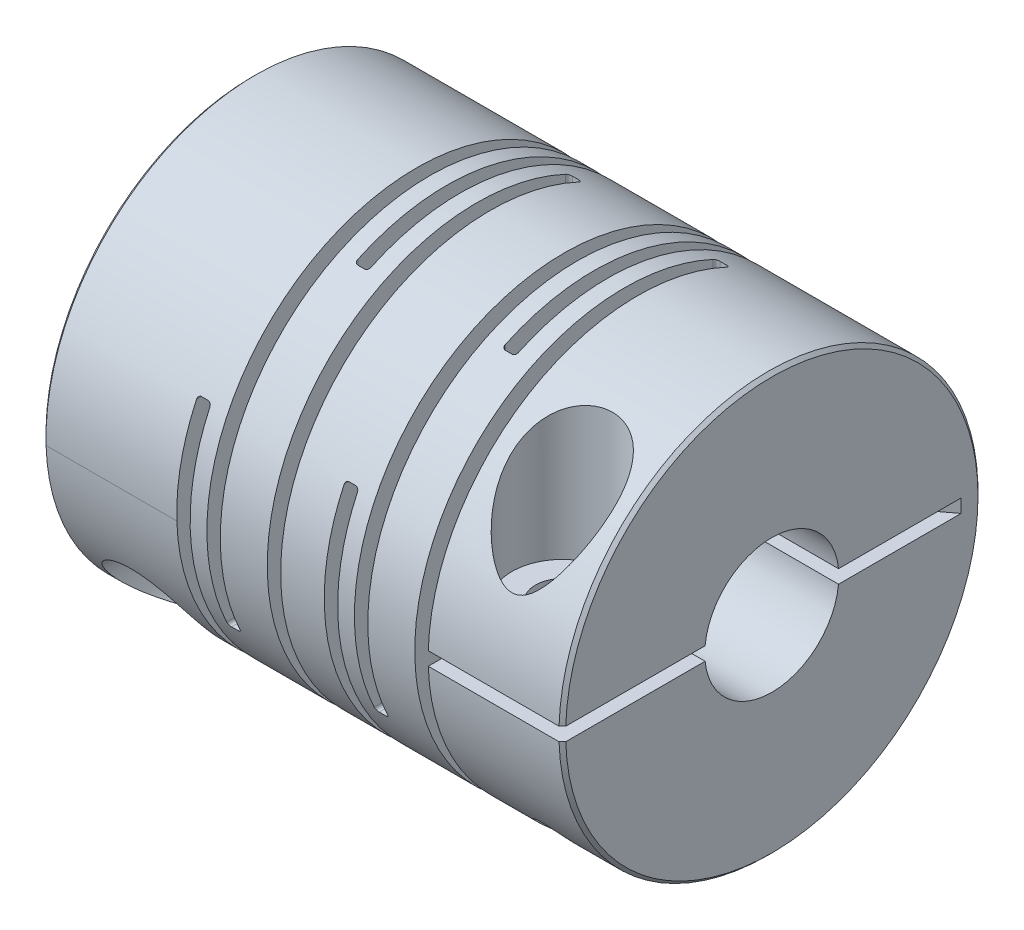
from build123d import *

# Parameters (mm, degrees)
SKETCH1_W                          = 31
SKETCH1_H                          = 12.5
CUT_EXTRUDE1_DEPTH                 = 42.740268327
CUT_EXTRUDE2_DEPTH                 = 42.740268491
CHAMFER1_SIZE                      = 0.2
CUT_EXTRUDE3_DEPTH                 = 0.4
CUT_EXTRUDE4_DEPTH                 = 0.4
SOCKET_HEAD_CAP_SCREW1_D           = 3.2
SOCKET_HEAD_CAP_SCREW1_DEPTH       = 12.1
SOCKET_HEAD_CAP_SCREW1_CBORE_D     = 6
SOCKET_HEAD_CAP_SCREW1_CBORE_DEPTH = 9.5
TAP1_D                             = 2.459
SOCKET_HEAD_CAP_SCREW2_D           = 3.2
SOCKET_HEAD_CAP_SCREW2_DEPTH       = 12.1
SOCKET_HEAD_CAP_SCREW2_CBORE_D     = 6
SOCKET_HEAD_CAP_SCREW2_CBORE_DEPTH = 9.5
TAP2_D                             = 2.459
SKETCH15_W                         = 15
SKETCH15_H                         = 4.25
SKETCH17_R                         = 4
CUT_EXTRUDE5_DEPTH                 = 8
CUT_EXTRUDE6_START                 = -8
SKETCH18_R                         = 4
CUT_EXTRUDE6_DEPTH                 = 8


with BuildPart() as part:
    # Sketch1 → Revolve1 (revolve)
    with BuildSketch(Plane.XY, mode=Mode.PRIVATE) as revolve1_sk:
        with Locations((15.5, 6.25)):
            Rectangle(SKETCH1_W, SKETCH1_H)
    revolve(revolve1_sk.sketch.rotate(Axis((0, 0, 0), (1, 0, 0)), 90), axis=Axis((0, 0, 0), (1, 0, 0)))

    # Sketch2 → Cut-Extrude1 (cut, through all)
    with BuildSketch(Plane.XY.offset(12.5)):
        with BuildLine():
            Line((19.4, 12.5), (19.4, -5.3))
            ThreePointArc((19.4, -5.3), (19.341421356, -5.441421356), (19.2, -5.5))
            Line((19.2, -5.5), (18.8, -5.5))
            ThreePointArc((18.8, -5.5), (18.658578644, -5.441421356), (18.6, -5.3))
            Line((18.6, -5.3), (18.6, 12.5))
            Line((18.6, 12.5), (19.4, 12.5))
        make_face()
        with BuildLine():
            Line((17.6, 5.3), (17.6, -12.5))
            Line((17.6, -12.5), (16.8, -12.5))
            Line((16.8, -12.5), (16.8, 5.3))
            ThreePointArc((16.8, 5.3), (16.858578644, 5.441421356), (17, 5.5))
            Line((17, 5.5), (17.4, 5.5))
            ThreePointArc((17.4, 5.5), (17.541421356, 5.441421356), (17.6, 5.3))
        make_face()
        with BuildLine():
            Line((10.6, 12.5), (10.6, -5.3))
            ThreePointArc((10.6, -5.3), (10.541421356, -5.441421356), (10.4, -5.5))
            Line((10.4, -5.5), (10, -5.5))
            ThreePointArc((10, -5.5), (9.858578644, -5.441421356), (9.8, -5.3))
            Line((9.8, -5.3), (9.8, 12.5))
            Line((9.8, 12.5), (10.6, 12.5))
        make_face()
        with BuildLine():
            Line((8.8, 5.3), (8.8, -12.5))
            Line((8.8, -12.5), (8, -12.5))
            Line((8, -12.5), (8, 5.3))
            ThreePointArc((8, 5.3), (8.058578644, 5.441421356), (8.2, 5.5))
            Line((8.2, 5.5), (8.6, 5.5))
            ThreePointArc((8.6, 5.5), (8.741421356, 5.441421356), (8.8, 5.3))
        make_face()
    extrude(amount=-CUT_EXTRUDE1_DEPTH, mode=Mode.SUBTRACT)

    # Sketch3 → Cut-Extrude2 (cut, through all)
    with BuildSketch(Plane(origin=(0, 12.5, 0), x_dir=(1, 0, 0), z_dir=(0, 1, 0))):
        with BuildLine():
            Line((21.2, 12.5), (21.2, -5.3))
            ThreePointArc((21.2, -5.3), (21.141421356, -5.441421356), (21, -5.5))
            Line((21, -5.5), (20.6, -5.5))
            ThreePointArc((20.6, -5.5), (20.458578644, -5.441421356), (20.4, -5.3))
            Line((20.4, -5.3), (20.4, 12.5))
            Line((20.4, 12.5), (21.2, 12.5))
        make_face()
        with BuildLine():
            Line((23, 5.3), (23, -12.5))
            Line((23, -12.5), (22.2, -12.5))
            Line((22.2, -12.5), (22.2, 5.3))
            ThreePointArc((22.2, 5.3), (22.258578644, 5.441421356), (22.4, 5.5))
            Line((22.4, 5.5), (22.8, 5.5))
            ThreePointArc((22.8, 5.5), (22.941421356, 5.441421356), (23, 5.3))
        make_face()
        with BuildLine():
            Line((12.4, 12.5), (12.4, -5.3))
            ThreePointArc((12.4, -5.3), (12.341421356, -5.441421356), (12.2, -5.5))
            Line((12.2, -5.5), (11.8, -5.5))
            ThreePointArc((11.8, -5.5), (11.658578644, -5.441421356), (11.6, -5.3))
            Line((11.6, -5.3), (11.6, 12.5))
            Line((11.6, 12.5), (12.4, 12.5))
        make_face()
        with BuildLine():
            Line((14.2, 5.3), (14.2, -12.5))
            Line((14.2, -12.5), (13.4, -12.5))
            Line((13.4, -12.5), (13.4, 5.3))
            ThreePointArc((13.4, 5.3), (13.458578644, 5.441421356), (13.6, 5.5))
            Line((13.6, 5.5), (14, 5.5))
            ThreePointArc((14, 5.5), (14.141421356, 5.441421356), (14.2, 5.3))
        make_face()
    extrude(amount=-CUT_EXTRUDE2_DEPTH, mode=Mode.SUBTRACT)

    # Chamfer1
    chamfer1_edges = [part.edges().sort_by_distance(p)[0] for p in [
        (31, 0, -12.5),
        (0, 0, -12.5),
    ]]
    chamfer(chamfer1_edges, length=CHAMFER1_SIZE)

    # Sketch4 → Cut-Extrude3 (cut, symmetric)
    with BuildSketch(Plane.XY):
        with BuildLine():
            Line((8.4, -12.5), (-11.6, -12.5))
            Line((-11.6, -12.5), (-11.6, 15))
            ThreePointArc((-11.6, 15), (2.542135624, 9.142135624), (8.4, -5))
            Line((8.4, -5), (8.4, -12.5))
        make_face()
    extrude(amount=CUT_EXTRUDE3_DEPTH, both=True, mode=Mode.SUBTRACT)

    # Sketch5 → Cut-Extrude4 (cut, symmetric)
    with BuildSketch(Plane(origin=(0, 0, 0), x_dir=(1, 0, 0), z_dir=(0, 1, 0))):
        with BuildLine():
            Line((22.6, -12.5), (42.6, -12.5))
            Line((42.6, -12.5), (42.6, 15))
            ThreePointArc((42.6, 15), (28.457864376, 9.142135624), (22.6, -5))
            Line((22.6, -5), (22.6, -12.5))
        make_face()
    extrude(amount=CUT_EXTRUDE4_DEPTH, both=True, mode=Mode.SUBTRACT)

    # Socket Head Cap Screw1
    with Locations(Plane.XY.offset(12.5)):
        with Locations((4, -8.5)):
            CounterBoreHole(SOCKET_HEAD_CAP_SCREW1_D / 2, SOCKET_HEAD_CAP_SCREW1_CBORE_D / 2, SOCKET_HEAD_CAP_SCREW1_CBORE_DEPTH, depth=SOCKET_HEAD_CAP_SCREW1_DEPTH)

    # Tap1 (through all)
    with Locations(Plane.XY.offset(-0.4)):
        with Locations((4, -8.5)):
            Hole(TAP1_D / 2)

    # Socket Head Cap Screw2
    with Locations(Plane(origin=(0, 12.5, 0), x_dir=(1, 0, 0), z_dir=(0, 1, 0))):
        with Locations((27, -8.5)):
            CounterBoreHole(SOCKET_HEAD_CAP_SCREW2_D / 2, SOCKET_HEAD_CAP_SCREW2_CBORE_D / 2, SOCKET_HEAD_CAP_SCREW2_CBORE_DEPTH, depth=SOCKET_HEAD_CAP_SCREW2_DEPTH)

    # Tap2 (through all)
    with Locations(Plane(origin=(0, -0.4, 0), x_dir=(1, 0, 0), z_dir=(0, 1, 0))):
        with Locations((27, -8.5)):
            Hole(TAP2_D / 2)

    # Sketch15 → Cut-Revolve1 (revolve, cut)
    with BuildSketch(Plane.XY, mode=Mode.PRIVATE) as cut_revolve1_sk:
        with Locations((15.5, 2.125)):
            Rectangle(SKETCH15_W, SKETCH15_H)
    revolve(cut_revolve1_sk.sketch.rotate(Axis((0, 0, 0), (1, 0, 0)), 91.833778), axis=Axis((0, 0, 0), (1, 0, 0)), mode=Mode.SUBTRACT)

    # Sketch17 → Cut-Extrude5 (cut)
    with BuildSketch(Plane(origin=(0, 0, 0), x_dir=(0, 0, -1), z_dir=(1, 0, 0))):
        Circle(SKETCH17_R)
    extrude(amount=CUT_EXTRUDE5_DEPTH, mode=Mode.SUBTRACT)

    # Sketch18 → Cut-Extrude6 (cut)
    with BuildSketch(Plane(origin=(31, 0, 0), x_dir=(0, 0, -1), z_dir=(1, 0, 0)).offset(CUT_EXTRUDE6_START)):
        Circle(SKETCH18_R)
    extrude(amount=CUT_EXTRUDE6_DEPTH, mode=Mode.SUBTRACT)


solid = part.part
